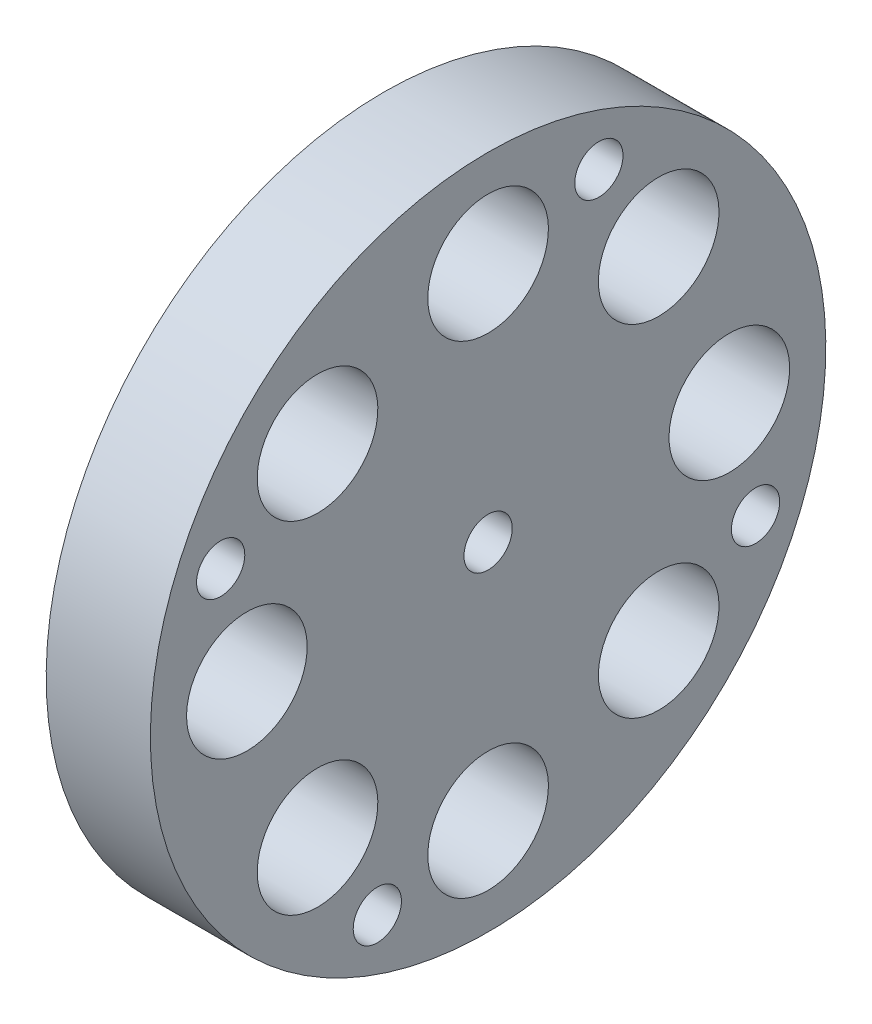
from build123d import *

# Parameters (mm, degrees)
SKETCH2_R          = 3.96875
CUT_EXTRUDE1_DEPTH = 33.341392209
SKETCH4_R          = 2.5
CUT_EXTRUDE2_DEPTH = 9.7155
SKETCH5_R          = 1.5875
CUT_EXTRUDE3_DEPTH = 2.38125
SKETCH6_W          = 1.1303
SKETCH6_H          = 22.225


with BuildPart() as part:
    # Sketch1 → Revolve1 (revolve)
    with BuildSketch(Plane.XY):
        Polygon((0, 0), (0, 22.225), (-6.858, 22.225), (-6.858, 6.35), (-14.478, 6.35), (-14.478, 0), align=None)
    revolve(axis=Axis((0, 0, 0), (-1, 0, 0)))

    # Sketch2 → Cut-Extrude1 (cut, through all)
    with BuildSketch(Plane.ZY.offset(6.858)):
        with Locations(Location((0, 15.875, 0), (0, 0, 270))):
            Circle(SKETCH2_R)
        with Locations(Location((11.225320151, 11.225320151, 0), (0, 0, 270))):
            Circle(SKETCH2_R)
        with Locations(Location((15.875, 0, 0), (0, 0, 270))):
            Circle(SKETCH2_R)
        with Locations(Location((11.225320151, -11.225320151, 0), (0, 0, 270))):
            Circle(SKETCH2_R)
        with Locations(Location((0, -15.875, 0), (0, 0, 270))):
            Circle(SKETCH2_R)
        with Locations(Location((-11.225320151, -11.225320151, 0), (0, 0, 270))):
            Circle(SKETCH2_R)
        with Locations(Location((-15.875, 0, 0), (0, 0, 270))):
            Circle(SKETCH2_R)
        with Locations(Location((-11.225320151, 11.225320151, 0), (0, 0, 270))):
            Circle(SKETCH2_R)
    extrude(amount=-CUT_EXTRUDE1_DEPTH, mode=Mode.SUBTRACT)

    # Sketch4 → Cut-Extrude2 (cut)
    with BuildSketch(Plane.ZY.offset(14.478)):
        with Locations(Location((0, 0, 0), (0, 0, 270))):
            Circle(SKETCH4_R)
    extrude(amount=-CUT_EXTRUDE2_DEPTH, mode=Mode.SUBTRACT)

    # Sketch5 → Cut-Extrude3 (cut)
    with BuildSketch(Plane(origin=(0, 0, 0), x_dir=(0, 0, -1), z_dir=(1, 0, 0))):
        with Locations(Location((0, 0, 0), (0, 0, 90))):
            Circle(SKETCH5_R)
        with Locations(Location((-17.599905094, 7.290119387, 0), (0, 0, 90))):
            Circle(SKETCH5_R)
        with Locations(Location((7.290119387, 17.599905094, 0), (0, 0, 90))):
            Circle(SKETCH5_R)
        with Locations(Location((17.599905094, -7.290119387, 0), (0, 0, 90))):
            Circle(SKETCH5_R)
        with Locations(Location((-7.290119387, -17.599905094, 0), (0, 0, 90))):
            Circle(SKETCH5_R)
    extrude(amount=-CUT_EXTRUDE3_DEPTH, mode=Mode.SUBTRACT)

    # Sketch6 → #4-40 Tapped Hole1 (revolve, cut)
    with BuildSketch(Plane.YZ.offset(-10.668)):
        with Locations((0.56515, 11.1125)):
            Rectangle(SKETCH6_W, SKETCH6_H)
    revolve(axis=Axis((-10.668, 0, -6.35), (0, 0, 1)), mode=Mode.SUBTRACT)


solid = part.part
